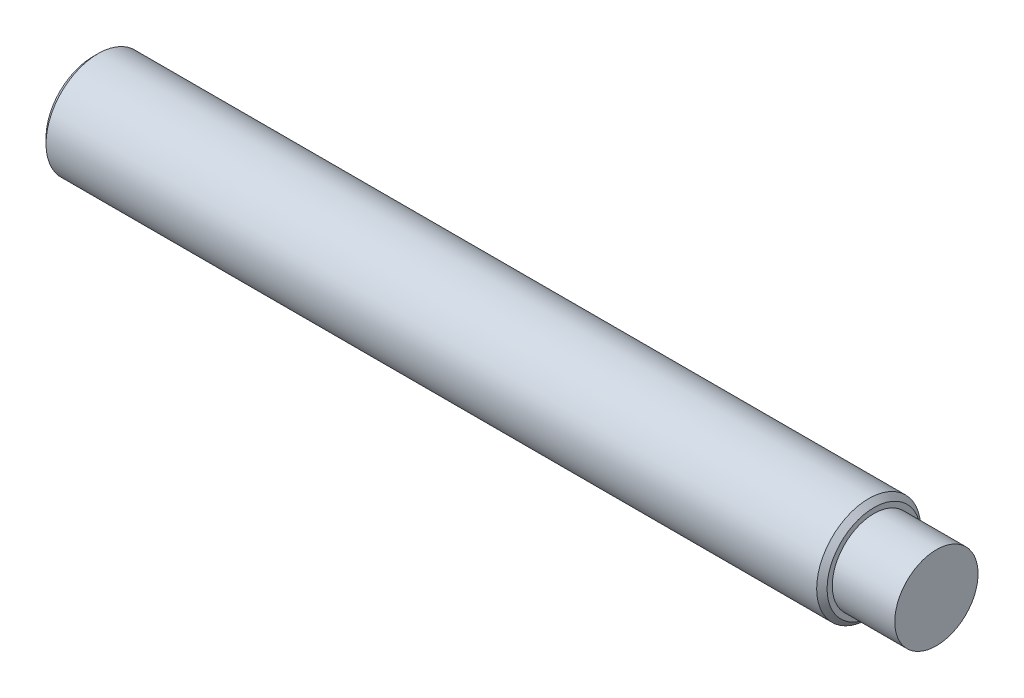
from build123d import *

# Parameters (mm, degrees)
CHAMFER1_SIZE      = 0.5
SKETCH6_R          = 2
CUT_EXTRUDE1_DEPTH = 10


with BuildPart() as part:
    # Sketch1 → Revolve1 (revolve)
    with BuildSketch(Plane.XY, mode=Mode.PRIVATE) as revolve1_sk:
        Polygon((0, 0), (0, 5), (75, 5), (75, 4), (81, 4), (81, 0), align=None)
    revolve(revolve1_sk.sketch.rotate(Axis((-21.625122332, 0, 0), (1, 0, 0)), 90), axis=Axis((-21.625122332, 0, 0), (1, 0, 0)))

    # Chamfer1
    chamfer1_edges = [part.edges().sort_by_distance(p)[0] for p in [
        (75, 0, -5),
        (0, 0, -5),
    ]]
    chamfer(chamfer1_edges, length=CHAMFER1_SIZE)

    # Sketch6 → Cut-Extrude1 (cut)
    with BuildSketch(Plane.ZY):
        Circle(SKETCH6_R)
    extrude(amount=-CUT_EXTRUDE1_DEPTH, mode=Mode.SUBTRACT)


solid = part.part
